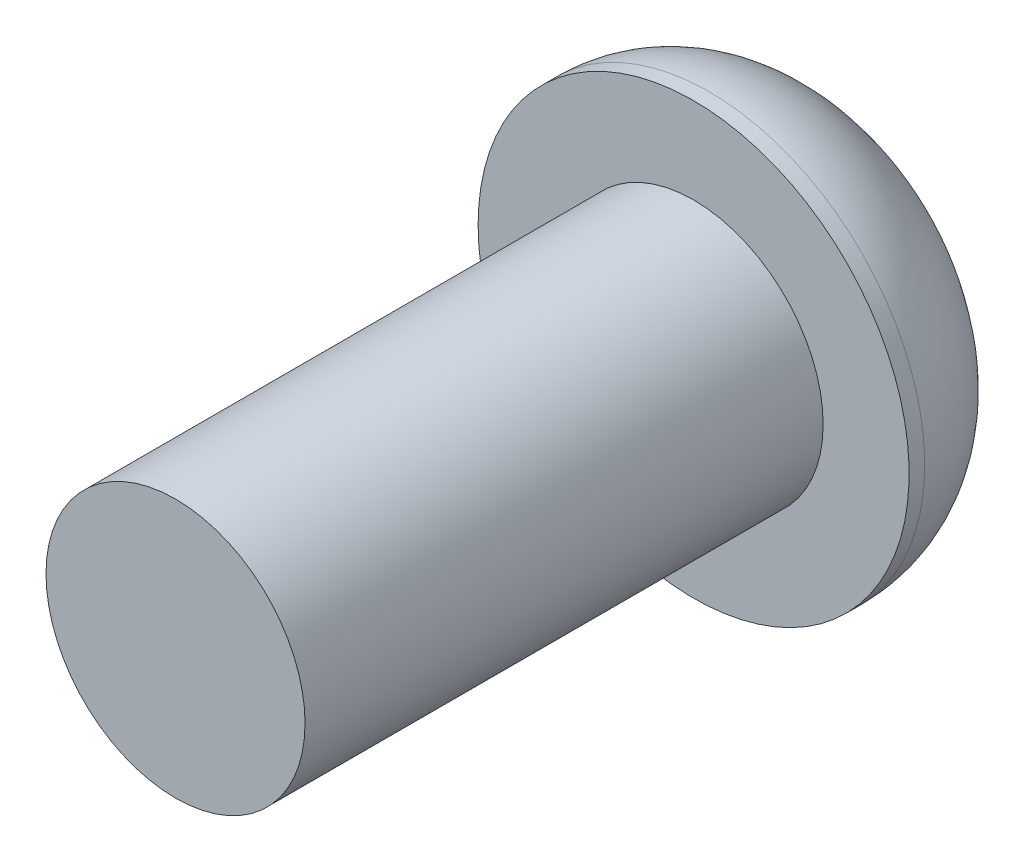
from build123d import *

# Parameters (mm, degrees)
SKETCH1_R           = 2.5
BOSS_EXTRUDE1_DEPTH = 10
SKETCH2_R           = 4.159584877
BOSS_EXTRUDE2_DEPTH = 2.8
FILLET1_R           = 2.5
CUT_EXTRUDE1_DEPTH  = 2


with BuildPart() as part:
    # Sketch1 → Boss-Extrude1 (new body)
    with BuildSketch(Plane.XY):
        Circle(SKETCH1_R)
    extrude(amount=BOSS_EXTRUDE1_DEPTH)

    # Sketch2 → Boss-Extrude2 (add)
    with BuildSketch(Plane(origin=(0, 0, 0), x_dir=(-1, 0, 0), z_dir=(0, 0, -1))):
        Circle(SKETCH2_R)
    extrude(amount=BOSS_EXTRUDE2_DEPTH)

    # Fillet1
    fillet1_edges = [part.edges().sort_by_distance(p)[0] for p in [
        (4.159584877, 0, -2.8),
    ]]
    fillet(fillet1_edges, radius=FILLET1_R)

    # Sketch3 → Cut-Extrude1 (cut)
    with BuildSketch(Plane(origin=(0, 0, -2.8), x_dir=(-1, 0, 0), z_dir=(0, 0, -1))):
        Polygon((1.392434699, -0.636521364), (1.247461021, 0.88762314), (-0.144973678, 1.524144504), (-1.392434699, 0.636521364), (-1.247461021, -0.88762314), (0.144973678, -1.524144504), align=None)
    extrude(amount=-CUT_EXTRUDE1_DEPTH, mode=Mode.SUBTRACT)


solid = part.part
